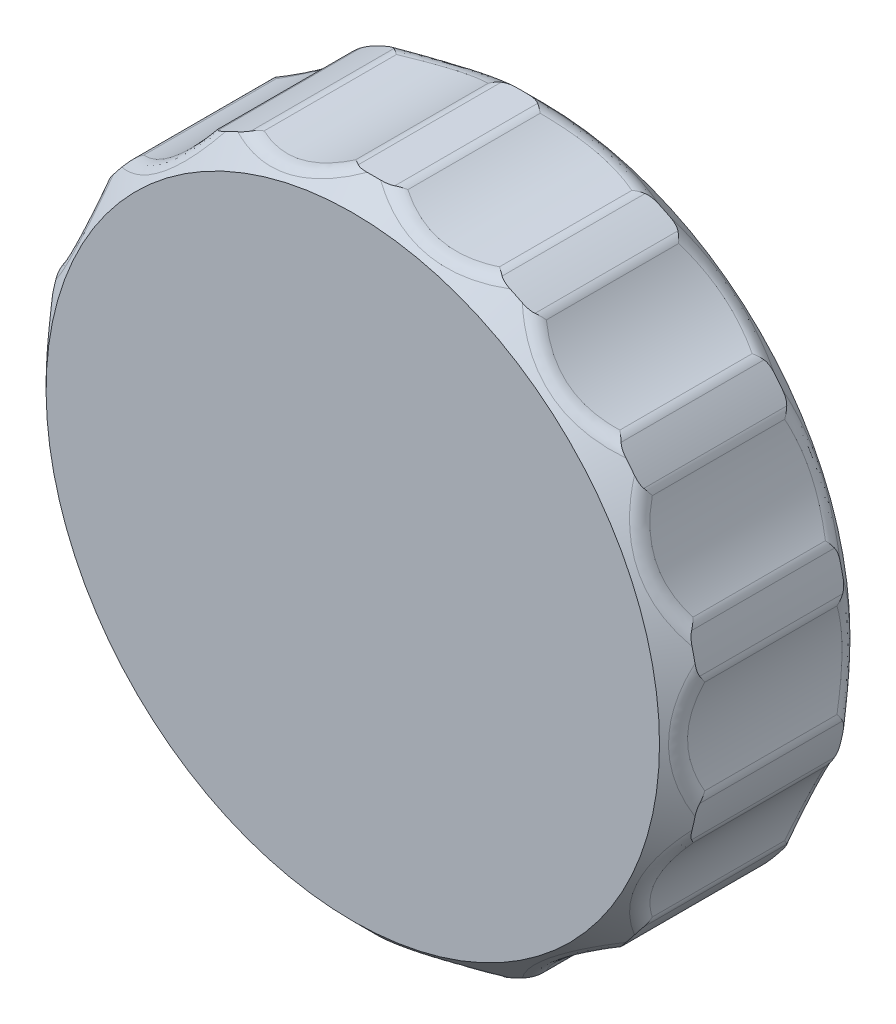
from build123d import *

# Parameters (mm, degrees)
SKETCH1_R            = 3.15
SKETCH1_R_2          = 2.15
BOSS_EXTRUDE3_DEPTH  = 11
SKETCH1_6_R          = 2.15
BOSS_EXTRUDE4_DEPTH  = 9
SKETCH1_7_R          = 4.025
SKETCH1_7_R_2        = 3.15
BOSS_EXTRUDE5_DEPTH  = 11
CHAMFER1_SIZE        = 0.5
BOSS_EXTRUDE6_START  = 2
SKETCH2_R            = 4.025
BOSS_EXTRUDE6_DEPTH  = 2
SKETCH3_R            = 15.5
SKETCH3_R_2          = 13.5
SKETCH3_R_3          = 4.025
BOSS_EXTRUDE7_DEPTH  = 2
SKETCH3_3_R          = 15.5
SKETCH3_3_R_2        = 13.5
BOSS_EXTRUDE8_DEPTH  = 7
CHAMFER2_SIZE        = 1
BOSS_EXTRUDE9_START  = 4
SKETCH2_2_R          = 4.025
BOSS_EXTRUDE9_DEPTH  = 4
SKETCH4_R            = 6.194271895
BOSS_EXTRUDE10_DEPTH = 0.75
SKETCH7_R            = 8.75
CUT_EXTRUDE1_DEPTH   = 27.561249971
CIRPATTERN1_COUNT    = 14
FILLET1_R            = 0.9


with BuildPart() as part:
    # Sketch1 → Boss-Extrude3 (new body)
    with BuildSketch(Plane.XY):
        Circle(SKETCH1_R)
        Circle(SKETCH1_R_2, mode=Mode.SUBTRACT)
    extrude(amount=-BOSS_EXTRUDE3_DEPTH)

    # Sketch1<6> → Boss-Extrude4 (add)
    with BuildSketch(Plane.XY):
        Circle(SKETCH1_6_R)
    extrude(amount=-BOSS_EXTRUDE4_DEPTH)

    # Sketch1<7> → Boss-Extrude5 (add)
    with BuildSketch(Plane.XY):
        Circle(SKETCH1_7_R)
        Circle(SKETCH1_7_R_2, mode=Mode.SUBTRACT)
    extrude(amount=-BOSS_EXTRUDE5_DEPTH)

    # Chamfer1
    chamfer1_edges = [part.edges().sort_by_distance(p)[0] for p in [
        (-4.025, 0, -11),
        (-2.15, 0, -11),
    ]]
    chamfer(chamfer1_edges, length=CHAMFER1_SIZE)

    # Sketch2 → Boss-Extrude6 (add)
    with BuildSketch(Plane.XY.offset(BOSS_EXTRUDE6_START)):
        Circle(SKETCH2_R)
    extrude(amount=-BOSS_EXTRUDE6_DEPTH)



with BuildPart() as body_2:
    # Sketch3 → Boss-Extrude7 (new body)
    # profile 1 of 2: a face of its own
    with BuildSketch(Plane.XY.offset(2)):
        Circle(SKETCH3_R)
        Circle(SKETCH3_R_2, mode=Mode.SUBTRACT)
    # profile 2 of 2: a face of its own
    with BuildSketch(Plane.XY.offset(2)):
        Circle(SKETCH3_R_2)
        Circle(SKETCH3_R_3, mode=Mode.SUBTRACT)
    extrude(amount=BOSS_EXTRUDE7_DEPTH)

    # Sketch3<3> → Boss-Extrude8 (add)
    with BuildSketch(Plane.XY.offset(2)):
        Circle(SKETCH3_3_R)
        Circle(SKETCH3_3_R_2, mode=Mode.SUBTRACT)
    extrude(amount=-BOSS_EXTRUDE8_DEPTH)

    # Chamfer2
    chamfer2_edges = [body_2.edges().sort_by_distance(p)[0] for p in [
        (-15.5, 0, -5),
        (-15.5, 0, 4),
    ]]
    chamfer(chamfer2_edges, length=CHAMFER2_SIZE)


with BuildPart() as part_1:
    add(part.part)

    add(body_2.part)  # Boss-Extrude9 merges body 2
    # Sketch2<2> → Boss-Extrude9 (add)
    with BuildSketch(Plane.XY.offset(BOSS_EXTRUDE9_START)):
        Circle(SKETCH2_2_R)
    extrude(amount=-BOSS_EXTRUDE9_DEPTH)

    # Sketch4 → Boss-Extrude10 (add)
    with BuildSketch(Plane(origin=(0, 0, 2), x_dir=(-1, 0, 0), z_dir=(0, 0, -1))):
        with Locations(Location((0, 0, 0), (0, 0, 180))):
            Circle(SKETCH4_R)
    extrude(amount=BOSS_EXTRUDE10_DEPTH)

    # Sketch7 → Cut-Extrude1 (cut, through all)
    with BuildSketch(Plane.XY.offset(4)):
        with Locations((23.725906488, 0)):
            Circle(SKETCH7_R)
    cut_extrude1 = extrude(amount=-CUT_EXTRUDE1_DEPTH, mode=Mode.SUBTRACT)

    # CirPattern1: Cut-Extrude1 ×14 about axis
    cirpattern1_axis = Axis((0, 0, 0), (0, 0, 1))
    for i in range(1, CIRPATTERN1_COUNT):
        add(cut_extrude1.rotate(cirpattern1_axis, i * 360 / CIRPATTERN1_COUNT), mode=Mode.SUBTRACT)

    # Fillet1
    fillet1_edges = [part_1.edges().sort_by_distance(p)[0] for p in [
        (13.492825515, 6.497802303, -4.524093512),
        (9.33732497, 11.708635171, -4.524093512),
        (-9.33732497, -11.708635171, -4.524093512),
        (-9.337324968, 11.708635172, -4.524093512),
        (3.332452699, 14.600429246, -4.524093512),
        (-3.332452698, 14.600429246, -4.524093512),
        (-13.492825514, 6.497802305, -4.524093512),
        (-14.975906488, 1e-09, -4.524093512),
        (-13.492825515, -6.497802303, -4.524093512),
        (-3.332452699, -14.600429246, -4.524093512),
        (3.332452698, -14.600429246, -4.524093512),
        (9.337324968, -11.708635172, -4.524093512),
        (13.492825514, -6.497802305, -4.524093512),
        (14.838963415, 4.478299315, -0.5),
        (12.753217752, 8.809394813, -0.5),
        (11.426382818, 10.473193195, -0.5),
        (7.667998999, 13.470404276, -0.5),
        (-11.426382818, -10.473193195, -0.5),
        (-7.667998999, -13.470404276, -0.5),
        (-7.667998999, 13.470404276, -0.5),
        (-11.426382818, 10.473193195, -0.5),
        (5.750666967, 14.393742718, -0.5),
        (1.064039003, 15.463434968, -0.5),
        (-1.064039003, 15.463434968, -0.5),
        (-5.750666967, 14.393742718, -0.5),
        (-12.753217752, 8.809394813, -0.5),
        (-14.838963415, 4.478299315, -0.5),
        (-15.312505321, 2.403576667, -0.5),
        (-15.312505321, -2.403576667, -0.5),
        (-14.838963415, -4.478299315, -0.5),
        (-12.753217752, -8.809394813, -0.5),
        (-5.750666967, -14.393742718, -0.5),
        (-1.064039003, -15.463434968, -0.5),
        (1.064039003, -15.463434968, -0.5),
        (5.750666967, -14.393742718, -0.5),
        (7.667998999, -13.470404276, -0.5),
        (11.426382818, -10.473193195, -0.5),
        (12.753217752, -8.809394813, -0.5),
        (14.838963415, -4.478299315, -0.5),
        (15.064113933, 1.239294109, 3.384994913),
        (15.06411393, -1.239294111, -4.384994919),
        (15.312505321, -2.403576667, -0.5),
        (15.312505321, 2.403576667, -0.5),
        (13.492825514, -6.497802305, 3.524093512),
        (9.337324968, -11.708635172, 3.524093512),
        (3.332452698, -14.600429246, 3.524093512),
        (-3.332452699, -14.600429246, 3.524093512),
        (-13.492825515, -6.497802303, 3.524093512),
        (-14.975906488, 1e-09, 3.524093512),
        (-13.492825514, 6.497802305, 3.524093512),
        (-3.332452698, 14.600429246, 3.524093512),
        (3.332452699, 14.600429246, 3.524093512),
        (-9.337324968, 11.708635172, 3.524093512),
        (-9.33732497, -11.708635171, 3.524093512),
        (9.33732497, 11.708635171, 3.524093512),
        (13.492825515, 6.497802303, 3.524093512),
    ]]
    fillet(fillet1_edges, radius=FILLET1_R)


solid = part_1.part
